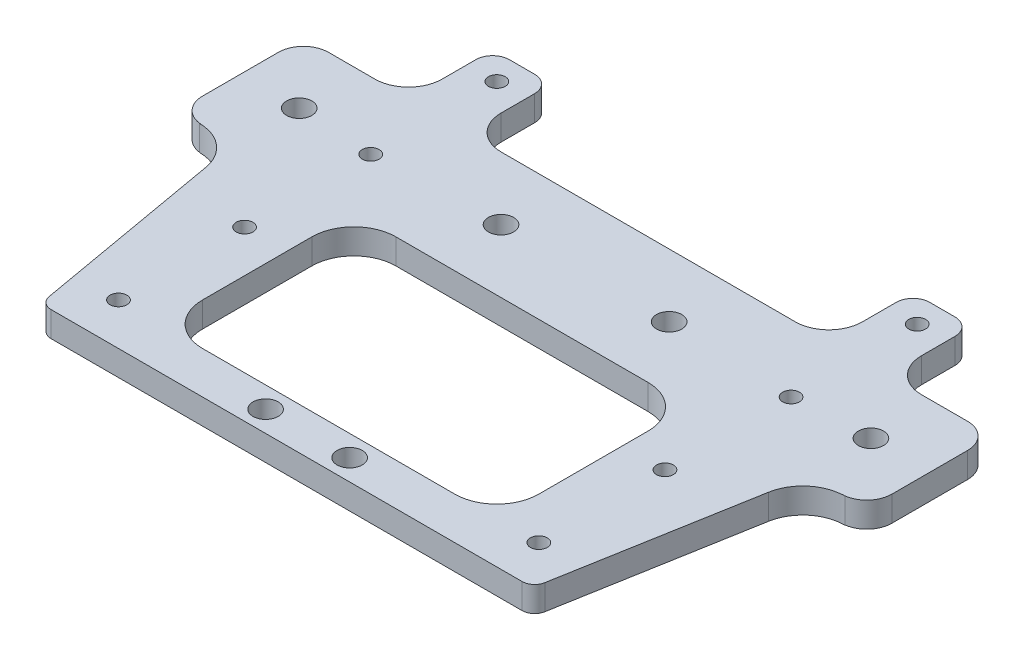
from build123d import *

# Parameters (mm, degrees)
SKETCH_1_R      = 1
SKETCH_1_R_2    = 1.5
EXTRUDE_1_DEPTH = 3


with BuildPart() as part:
    # 草图1 → 凸台-拉伸1 (new body)
    with BuildSketch(Plane(origin=(0, 0, 0), x_dir=(1, 0, 0), z_dir=(0, 1, 0))):
        with BuildLine():
            Line((-28.5, -2), (-28.5, -6))
            ThreePointArc((-28.5, -6), (-29.671572875, -8.828427125), (-32.5, -10))
            Line((-32.5, -10), (-38, -10))
            ThreePointArc((-38, -10), (-40.121320344, -10.878679656), (-41, -13))
            Line((-41, -13), (-41, -22))
            ThreePointArc((-41, -22), (-40.121320344, -24.121320344), (-38, -25))
            Line((-38, -25), (-38.391303062, -25))
            ThreePointArc((-38.391303062, -25), (-35.177365014, -26.169777784), (-33.467264297, -29.131759112))
            Line((-33.467264297, -29.131759112), (-29.47721163, -51.760472267))
            ThreePointArc((-29.47721163, -51.760472267), (-28.964181415, -52.649066665), (-28, -53))
            Line((-28, -53), (-22, -53))
            Line((-22, -53), (22, -53))
            Line((22, -53), (28, -53))
            ThreePointArc((28, -53), (28.964181415, -52.649066665), (29.47721163, -51.760472267))
            Line((29.47721163, -51.760472267), (33.467264297, -29.131759112))
            ThreePointArc((33.467264297, -29.131759112), (35.177365014, -26.169777784), (38.391303062, -25))
            Line((38.391303062, -25), (38, -25))
            ThreePointArc((38, -25), (40.121320344, -24.121320344), (41, -22))
            Line((41, -22), (41, -13))
            ThreePointArc((41, -13), (40.121320344, -10.878679656), (38, -10))
            Line((38, -10), (32.5, -10))
            ThreePointArc((32.5, -10), (29.671572875, -8.828427125), (28.5, -6))
            Line((28.5, -6), (28.5, -2))
            ThreePointArc((28.5, -2), (27.914213562, -0.585786438), (26.5, 0))
            Line((26.5, 0), (23.5, 0))
            ThreePointArc((23.5, 0), (22.085786438, -0.585786438), (21.5, -2))
            Line((21.5, -2), (21.5, -6))
            ThreePointArc((21.5, -6), (20.328427125, -8.828427125), (17.5, -10))
            Line((17.5, -10), (-17.5, -10))
            ThreePointArc((-17.5, -10), (-20.328427125, -8.828427125), (-21.5, -6))
            Line((-21.5, -6), (-21.5, -2))
            ThreePointArc((-21.5, -2), (-22.085786438, -0.585786438), (-23.5, 0))
            Line((-23.5, 0), (-26.5, 0))
            ThreePointArc((-26.5, 0), (-27.914213562, -0.585786438), (-28.5, -2))
        make_face()
        with Locations(Location((-25, -48, 0), (0, 0, 270))):
            Circle(SKETCH_1_R, mode=Mode.SUBTRACT)
        with Locations(Location((-25, -33, 0), (0, 0, 270))):
            Circle(SKETCH_1_R, mode=Mode.SUBTRACT)
        with Locations(Location((-25, -18, 0), (0, 0, 270))):
            Circle(SKETCH_1_R, mode=Mode.SUBTRACT)
        with Locations(Location((-34, -17.5, 0), (0, 0, 270))):
            Circle(SKETCH_1_R_2, mode=Mode.SUBTRACT)
        with Locations(Location((-10, -17.5, 0), (0, 0, 270))):
            Circle(SKETCH_1_R_2, mode=Mode.SUBTRACT)
        with Locations(Location((10, -17.5, 0), (0, 0, 270))):
            Circle(SKETCH_1_R_2, mode=Mode.SUBTRACT)
        with Locations(Location((34, -17.5, 0), (0, 0, 270))):
            Circle(SKETCH_1_R_2, mode=Mode.SUBTRACT)
        with Locations(Location((25, -18, 0), (0, 0, 270))):
            Circle(SKETCH_1_R, mode=Mode.SUBTRACT)
        with Locations(Location((25, -33, 0), (0, 0, 270))):
            Circle(SKETCH_1_R, mode=Mode.SUBTRACT)
        with Locations(Location((25, -48, 0), (0, 0, 270))):
            Circle(SKETCH_1_R, mode=Mode.SUBTRACT)
        with Locations(Location((-25, -3, 0), (0, 0, 270))):
            Circle(SKETCH_1_R, mode=Mode.SUBTRACT)
        with Locations(Location((25, -3, 0), (0, 0, 270))):
            Circle(SKETCH_1_R, mode=Mode.SUBTRACT)
        with Locations(Location((5, -50.5, 0), (0, 0, 270))):
            Circle(SKETCH_1_R_2, mode=Mode.SUBTRACT)
        with Locations(Location((-5, -50.5, 0), (0, 0, 270))):
            Circle(SKETCH_1_R_2, mode=Mode.SUBTRACT)
        with BuildLine():
            Line((-20, -43), (-20, -30))
            ThreePointArc((-20, -30), (-18.535533906, -26.464466094), (-15, -25))
            Line((-15, -25), (15, -25))
            ThreePointArc((15, -25), (18.535533906, -26.464466094), (20, -30))
            Line((20, -30), (20, -43))
            ThreePointArc((20, -43), (18.535533906, -46.535533906), (15, -48))
            Line((15, -48), (-15, -48))
            ThreePointArc((-15, -48), (-18.535533906, -46.535533906), (-20, -43))
        make_face(mode=Mode.SUBTRACT)
    extrude(amount=EXTRUDE_1_DEPTH)


solid = part.part
